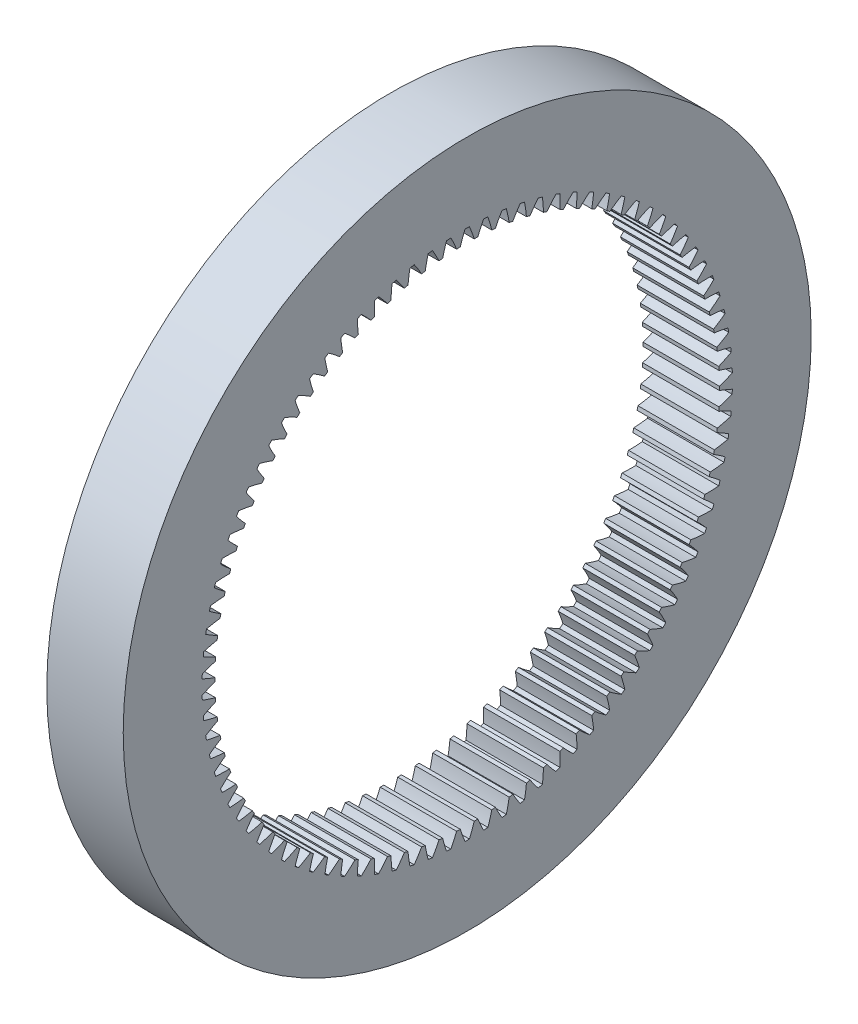
from build123d import *

# Parameters (mm, degrees)
BASPROSKE_W     = 20
BASPROSKE_H     = 24
TOOTHCUT_DEPTH  = 129.840987267
TEETHCUTS_COUNT = 90
TEETHCUTS_ANGLE = 356


with BuildPart() as part:
    # BasProSke → Base-Revolve (revolve)
    with BuildSketch(Plane(origin=(0, 0, 0), x_dir=(1, 0, 0), z_dir=(0, 1, 0)), mode=Mode.PRIVATE) as base_revolve_sk:
        with Locations((10, 78)):
            Rectangle(BASPROSKE_W, BASPROSKE_H)
    revolve(base_revolve_sk.sketch.rotate(Axis((-10, 0, 0), (1, 0, 0)), 180), axis=Axis((-10, 0, 0), (1, 0, 0)))

    # TooCutSke → ToothCut (cut, through all)
    with BuildSketch(Plane(origin=(0, 0, 0), x_dir=(0, 0, -1), z_dir=(1, 0, 0))):
        with BuildLine():
            ThreePointArc((1.822665214, 65.949418016), (1.241051866, 67.678527471), (0.566857879, 69.373684118))
            ThreePointArc((0.566857879, 69.373684118), (0, 69.376), (-0.566857879, 69.373684118))
            ThreePointArc((-0.566857879, 69.373684118), (-1.241051866, 67.678527471), (-1.822665214, 65.949418016))
            ThreePointArc((-1.822665214, 65.949418016), (0, 65.9746), (1.822665214, 65.949418016))
        make_face()
    toothcut = extrude(amount=TOOTHCUT_DEPTH, mode=Mode.SUBTRACT)

    # TeethCuts: ToothCut ×90 about axis
    teethcuts_axis = Axis((-10, 0, 0), (1, 0, 0))
    for i in range(1, TEETHCUTS_COUNT):
        add(toothcut.rotate(teethcuts_axis, i * TEETHCUTS_ANGLE / (TEETHCUTS_COUNT - 1)), mode=Mode.SUBTRACT)


solid = part.part
